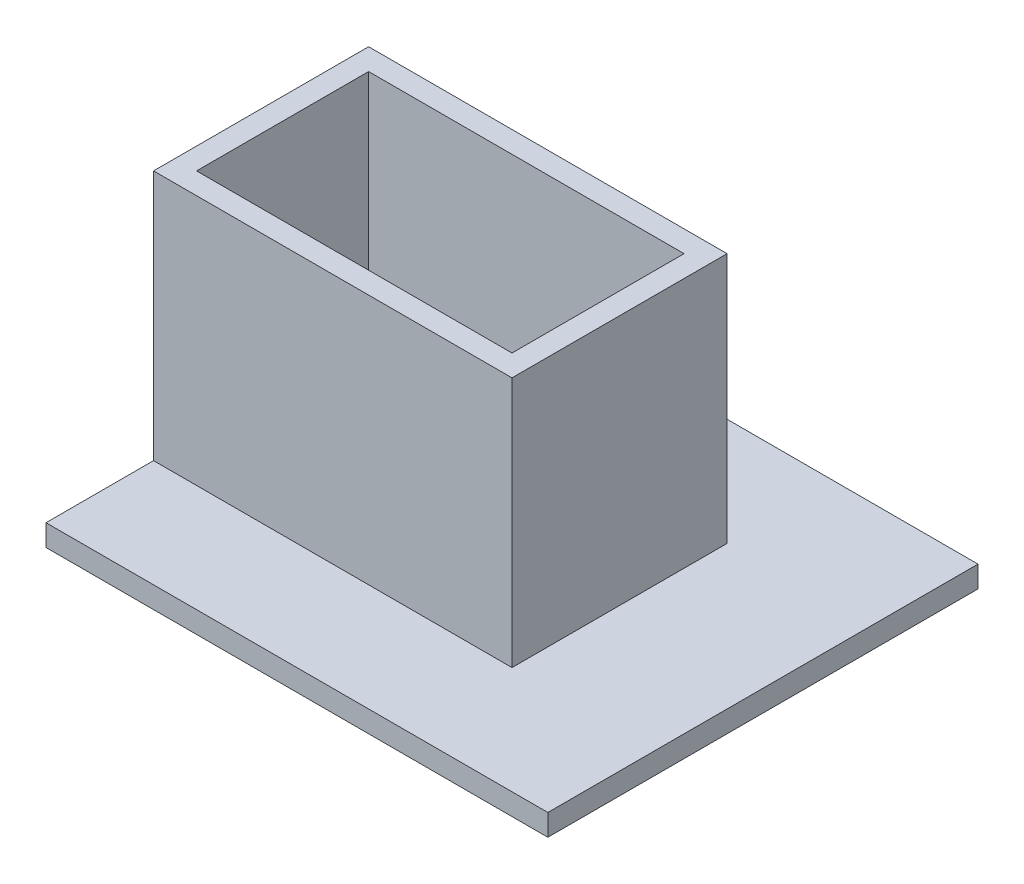
from build123d import *

# Parameters (mm, degrees)
SKETCH1_W           = 40
SKETCH1_H           = 20
BOSS_EXTRUDE1_DEPTH = 35
SKETCH2_W           = 50
SKETCH2_H           = 30
SKETCH2_W_2         = 44
SKETCH2_H_2         = 24
BOSS_EXTRUDE2_DEPTH = 35
SKETCH3_W           = 70
SKETCH3_H           = 60
BOSS_EXTRUDE4_DEPTH = 3
SKETCH6_W           = 40
SKETCH6_H           = 20
CUT_EXTRUDE1_DEPTH  = 35


with BuildPart() as part:
    # Sketch1 → Boss-Extrude1 (new body)
    with BuildSketch(Plane(origin=(0, 0, 0), x_dir=(1, 0, 0), z_dir=(0, 1, 0))):
        Rectangle(SKETCH1_W, SKETCH1_H)
    extrude(amount=BOSS_EXTRUDE1_DEPTH)



with BuildPart() as body_2:
    # Sketch2 → Boss-Extrude2 (new body)
    with BuildSketch(Plane(origin=(0, 0, 0), x_dir=(1, 0, 0), z_dir=(0, 1, 0))):
        Rectangle(SKETCH2_W, SKETCH2_H)
        Rectangle(SKETCH2_W_2, SKETCH2_H_2, mode=Mode.SUBTRACT)
    extrude(amount=BOSS_EXTRUDE2_DEPTH)


with BuildPart() as part_1:
    add(part.part)

    add(body_2.part)  # Boss-Extrude4 merges body 2
    # Sketch3 → Boss-Extrude4 (add)
    with BuildSketch(Plane.XZ):
        with Locations((10, 0)):
            Rectangle(SKETCH3_W, SKETCH3_H)
    extrude(amount=BOSS_EXTRUDE4_DEPTH)

    # Sketch6 → Cut-Extrude1 (cut)
    with BuildSketch(Plane(origin=(0, 35, 0), x_dir=(1, 0, 0), z_dir=(0, 1, 0))):
        Rectangle(SKETCH6_W, SKETCH6_H)
    extrude(amount=-CUT_EXTRUDE1_DEPTH, mode=Mode.SUBTRACT)


solid = part_1.part
